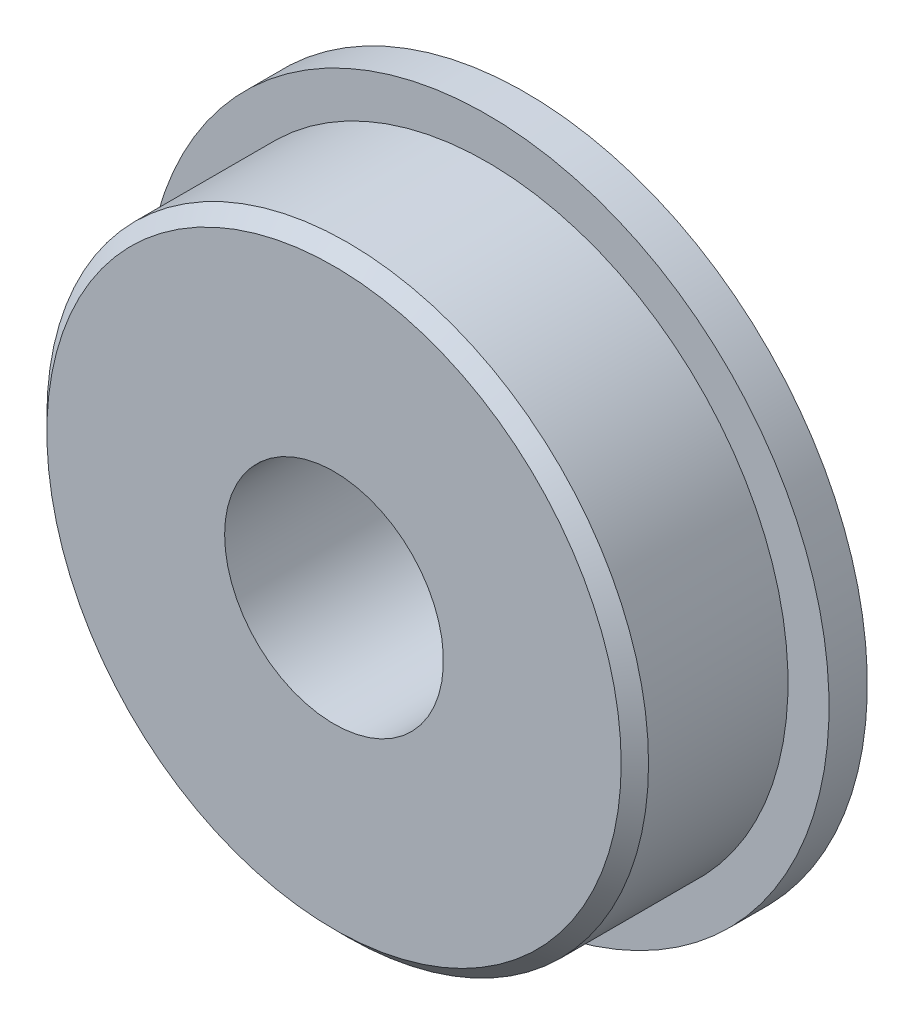
from build123d import *

# Parameters (mm, degrees)
CHAMFER1_SIZE = 0.5


with BuildPart() as part:
    # Sketch1 → Revolve1 (revolve)
    with BuildSketch(Plane(origin=(0, 0, 0), x_dir=(1, 0, 0), z_dir=(0, 1, 0))):
        Polygon((-12.5, 0), (-12.5, -1.4), (-11, -1.4), (-11, -7), (-4, -7), (-4, 0), align=None)
    revolve(axis=Axis((0, 0, -20.178571429), (0, 0, 1)))

    # Chamfer1
    chamfer1_edges = [part.edges().sort_by_distance(p)[0] for p in [
        (11, 0, 7),
    ]]
    chamfer(chamfer1_edges, length=CHAMFER1_SIZE)


solid = part.part
